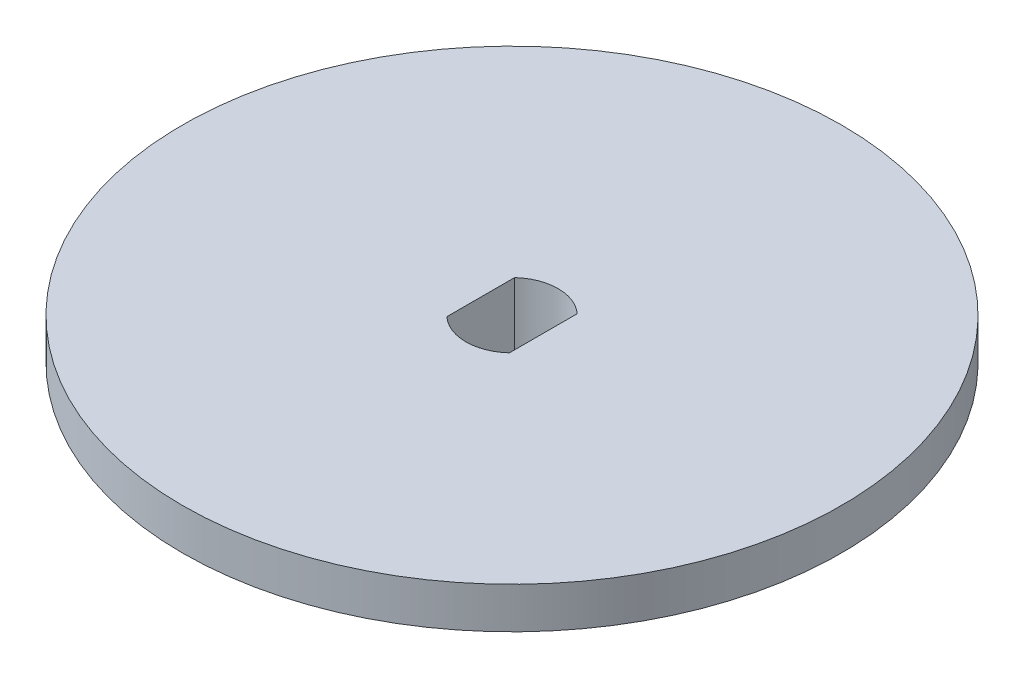
from build123d import *

# Parameters (mm, degrees)
BOSS_EXTRUDE1_DEPTH = 5.5
SKETCH2_R           = 20
BOSS_EXTRUDE2_DEPTH = 2.5
CUT_EXTRUDE1_DEPTH  = 8


with BuildPart() as part:
    # Sketch1 → Boss-Extrude1 (new body)
    with BuildSketch(Plane(origin=(0, 0, 0), x_dir=(1, 0, 0), z_dir=(0, 1, 0))):
        with BuildLine():
            ThreePointArc((-1.9, -2.05669638), (-2.8, 0), (-1.9, 2.05669638))
            Line((-1.9, 2.05669638), (-1.9, 5.532856405))
            ThreePointArc((-1.9, 5.532856405), (-5.85, 0), (-1.9, -5.532856405))
            Line((-1.9, -5.532856405), (-1.9, -2.05669638))
        make_face()
        with BuildLine():
            ThreePointArc((-1.9, 2.05669638), (0, 2.8), (1.9, 2.05669638))
            Line((1.9, 2.05669638), (1.9, 5.532856405))
            ThreePointArc((1.9, 5.532856405), (0, 5.85), (-1.9, 5.532856405))
            Line((-1.9, 5.532856405), (-1.9, 2.05669638))
        make_face()
        with BuildLine():
            Line((1.9, 5.532856405), (1.9, 2.05669638))
            ThreePointArc((1.9, 2.05669638), (2.565151068, 1.122497216), (2.8, 0))
            ThreePointArc((2.8, 0), (2.565151068, -1.122497216), (1.9, -2.05669638))
            Line((1.9, -2.05669638), (1.9, -5.532856405))
            ThreePointArc((1.9, -5.532856405), (4.761171074, -3.399080758), (5.85, 0))
            ThreePointArc((5.85, 0), (4.761171074, 3.399080758), (1.9, 5.532856405))
        make_face()
        with BuildLine():
            Line((1.9, -5.532856405), (1.9, -2.05669638))
            ThreePointArc((1.9, -2.05669638), (0, -2.8), (-1.9, -2.05669638))
            Line((-1.9, -2.05669638), (-1.9, -5.532856405))
            ThreePointArc((-1.9, -5.532856405), (0, -5.85), (1.9, -5.532856405))
        make_face()
        with BuildLine():
            Line((-1.9, -2.05669638), (-1.9, 2.05669638))
            ThreePointArc((-1.9, 2.05669638), (-2.8, 0), (-1.9, -2.05669638))
        make_face()
        with BuildLine():
            ThreePointArc((2.8, 0), (2.565151068, 1.122497216), (1.9, 2.05669638))
            Line((1.9, 2.05669638), (1.9, -2.05669638))
            ThreePointArc((1.9, -2.05669638), (2.565151068, -1.122497216), (2.8, 0))
        make_face()
    extrude(amount=BOSS_EXTRUDE1_DEPTH)

    # Sketch2 → Boss-Extrude2 (add)
    with BuildSketch(Plane(origin=(0, 5.5, 0), x_dir=(1, 0, 0), z_dir=(0, 1, 0))):
        with Locations(Location((0, 0, 0), (0, 0, 270))):
            Circle(SKETCH2_R)
    extrude(amount=-BOSS_EXTRUDE2_DEPTH)

    # Sketch3 → Cut-Extrude1 (cut)
    with BuildSketch(Plane.XZ.offset(-3)):
        with BuildLine():
            Line((-1.9, 2.05669638), (-1.9, -2.05669638))
            ThreePointArc((-1.9, -2.05669638), (0, -2.8), (1.9, -2.05669638))
            Line((1.9, -2.05669638), (1.9, 2.05669638))
            ThreePointArc((1.9, 2.05669638), (0, 2.8), (-1.9, 2.05669638))
        make_face()
    extrude(amount=-CUT_EXTRUDE1_DEPTH, mode=Mode.SUBTRACT)


solid = part.part
